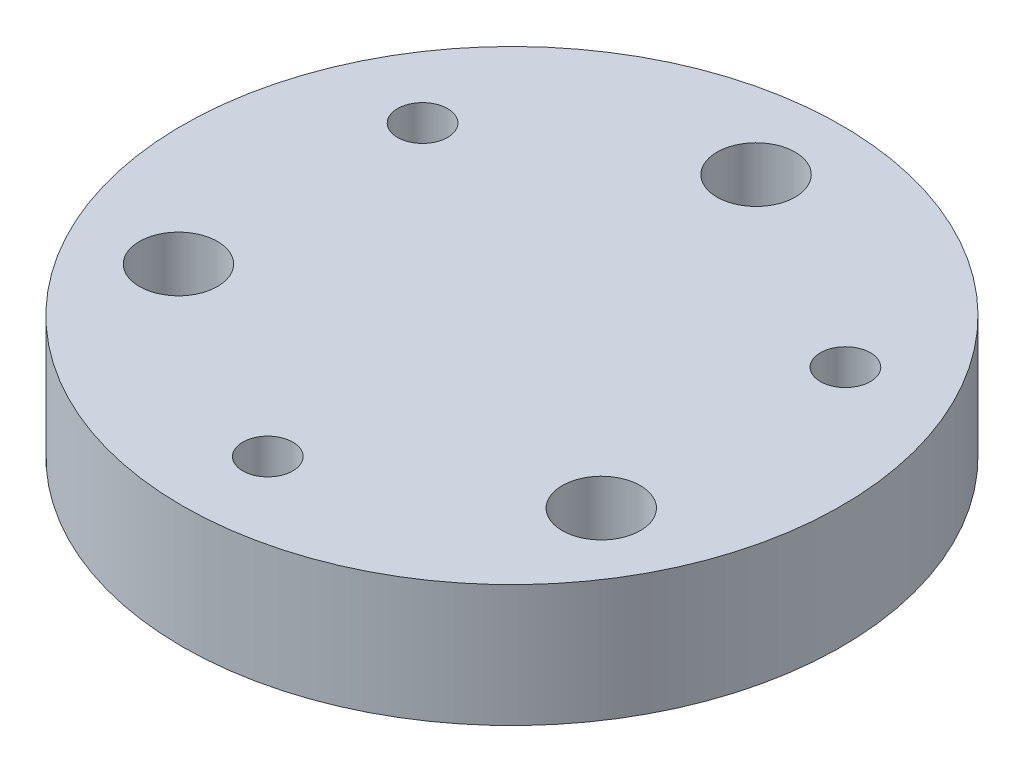
from build123d import *

# Parameters (mm, degrees)
SKETCH_1_R      = 13.5
SKETCH_1_R_2    = 1.6
SKETCH_1_R_3    = 1.025
EXTRUDE_1_DEPTH = 5


with BuildPart() as part:
    # 草图1 → 凸台-拉伸1 (new body)
    with BuildSketch(Plane(origin=(0, 0, 0), x_dir=(1, 0, 0), z_dir=(0, 1, 0))):
        with Locations(Location((0, 0, 0), (0, 0, 270))):
            Circle(SKETCH_1_R)
        with Locations(Location((0, 10, 0), (0, 0, 270))):
            Circle(SKETCH_1_R_2, mode=Mode.SUBTRACT)
        with Locations(Location((8.660254038, -5, 0), (0, 0, 270))):
            Circle(SKETCH_1_R_2, mode=Mode.SUBTRACT)
        with Locations(Location((-8.660254038, -5, 0), (0, 0, 270))):
            Circle(SKETCH_1_R_2, mode=Mode.SUBTRACT)
        with Locations(Location((8.660254038, 5, 0), (0, 0, 270))):
            Circle(SKETCH_1_R_3, mode=Mode.SUBTRACT)
        with Locations(Location((0, -10, 0), (0, 0, 270))):
            Circle(SKETCH_1_R_3, mode=Mode.SUBTRACT)
        with Locations(Location((-8.660254038, 5, 0), (0, 0, 270))):
            Circle(SKETCH_1_R_3, mode=Mode.SUBTRACT)
    extrude(amount=EXTRUDE_1_DEPTH)


solid = part.part
